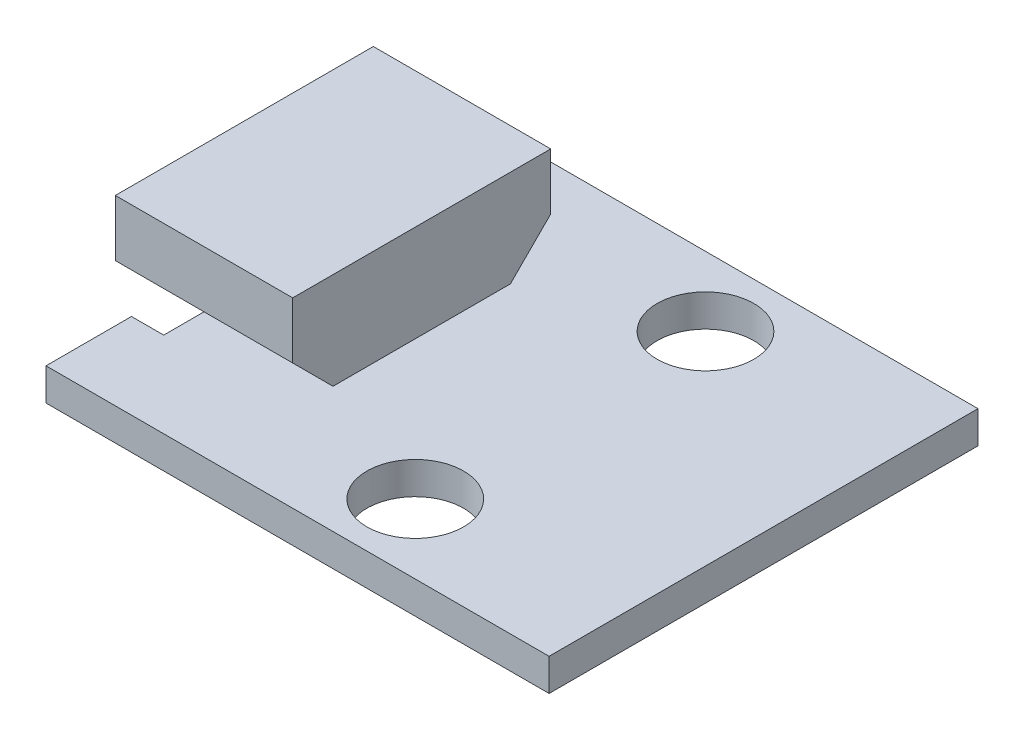
from build123d import *

# Parameters (mm, degrees)
SKETCH1_R           = 1.5
BOSS_EXTRUDE1_DEPTH = 1
BOSS_EXTRUDE2_DEPTH = 5.5
CUT_EXTRUDE1_DEPTH  = 5


with BuildPart() as part:
    # Sketch1 → Boss-Extrude1 (new body)
    with BuildSketch(Plane(origin=(0, 0, 0), x_dir=(1, 0, 0), z_dir=(0, 1, 0))):
        Polygon((-15.6, 0), (0, 0), (0, 13.3), (-15.6, 13.3), (-15.6, 10.65), (-14.6, 10.65), (-14.6, 2.65), (-15.6, 2.65), align=None)
        with Locations(Location((-6.3, 2.15, 0), (0, 0, 270))):
            Circle(SKETCH1_R, mode=Mode.SUBTRACT)
        with Locations(Location((-6.3, 11.15, 0), (0, 0, 270))):
            Circle(SKETCH1_R, mode=Mode.SUBTRACT)
    extrude(amount=BOSS_EXTRUDE1_DEPTH)


with BuildPart() as body_2:
    # Sketch2 → Boss-Extrude2 (new body)
    with BuildSketch(Plane.ZY.offset(16.1)):
        Polygon((-2.65, 4), (-10.65, 4), (-10.65, 2.25), (-9.4, 1), (-3.9, 1), (-2.65, 2.25), align=None)
    extrude(amount=-BOSS_EXTRUDE2_DEPTH)

    # Sketch3 → Cut-Extrude1 (cut)
    with BuildSketch(Plane.ZY.offset(16.1)):
        Polygon((-10.15, 3.5), (-10.15, 2.457106781), (-9.192893219, 1.5), (-4.107106781, 1.5), (-3.15, 2.457106781), (-3.15, 3.5), align=None)
    extrude(amount=-CUT_EXTRUDE1_DEPTH, mode=Mode.SUBTRACT)


solid = Compound([part.part, body_2.part])
